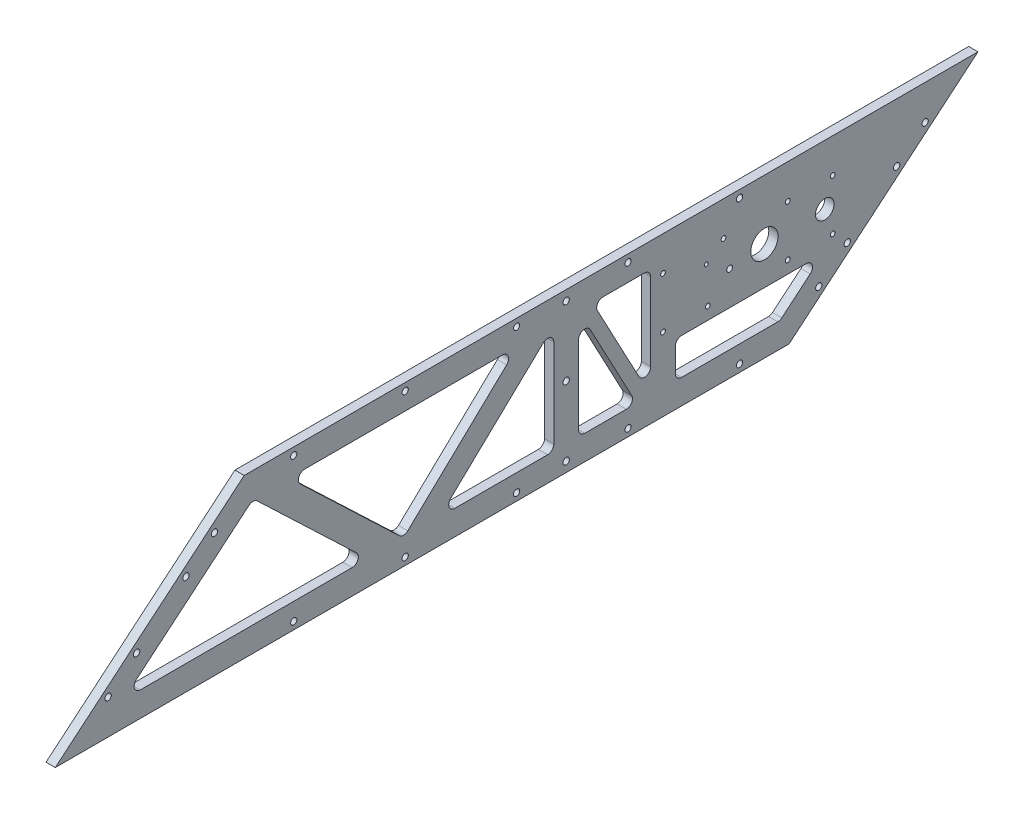
from build123d import *

# Parameters (mm, degrees)
BOSS_EXTRUDE1_DEPTH           = 4.7625
SKETCH2_R                     = 6.9977
SKETCH2_R_2                   = 1.4986
SKETCH2_R_3                   = 0.9906
SKETCH2_R_4                   = 4.7625
GEARBOX_WITH_PRESS_FITS_DEPTH = 412.602247496
SKETCH6_R                     = 1.59385
CUT_EXTRUDE2_DEPTH            = 412.602247496
F_4_CLEARANCE_HOLE2_D         = 3.2639
F_2_CLEARANCE_HOLE1_D         = 2.4384
F_2_CLEARANCE_HOLE1_DEPTH     = 4.826
F_2_CLEARANCE_HOLE1_TIP       = 0.732569267
F_4_CLEARANCE_HOLE1_D         = 3.2639
F_4_CLEARANCE_HOLE1_DEPTH     = 4.826
F_4_CLEARANCE_HOLE1_TIP       = 0.980574487
CUT_EXTRUDE3_DEPTH            = 412.602247496


with BuildPart() as part:
    # Sketch1 → Boss-Extrude1 (new body)
    with BuildSketch(Plane(origin=(0, 0, 0), x_dir=(0, 0, -1), z_dir=(1, 0, 0))):
        Polygon((33.297595377, -40.64), (312.697595377, -40.64), (345.995190754, -12.7), (409.563327383, 40.64), (312.697595377, 40.64), (33.297595377, 40.64), (0, 12.7), (-63.568136629, -40.64), align=None)
    extrude(amount=BOSS_EXTRUDE1_DEPTH)

    # Sketch2 → Gearbox (with Press fits) (cut, through all)
    with BuildSketch(Plane(origin=(4.7625, 0, 0), x_dir=(0, 0, -1), z_dir=(1, 0, 0))):
        with Locations((300.047997426, 10)):
            Circle(SKETCH2_R)
        with Locations((282.214696722, 8)):
            Circle(SKETCH2_R_2)
        with Locations((270.217776392, 15.933400182)):
            Circle(SKETCH2_R_3)
        with Locations((331.004197426, 10)):
            Circle(SKETCH2_R_4)
    extrude(amount=-GEARBOX_WITH_PRESS_FITS_DEPTH, mode=Mode.SUBTRACT)

    # Sketch6 → Cut-Extrude2 (cut, through all)
    with BuildSketch(Plane(origin=(4.7625, 0, 0), x_dir=(0, 0, -1), z_dir=(1, 0, 0))):
        with Locations((287.297595377, 36.83)):
            Circle(SKETCH6_R)
        with Locations((230.147595377, 36.83)):
            Circle(SKETCH6_R)
        with Locations((172.997595377, 36.83)):
            Circle(SKETCH6_R)
        with Locations((115.847595377, 36.83)):
            Circle(SKETCH6_R)
        with Locations((58.697595377, 36.83)):
            Circle(SKETCH6_R)
        with Locations((58.697595377, -36.83)):
            Circle(SKETCH6_R)
        with Locations((115.847595377, -36.83)):
            Circle(SKETCH6_R)
        with Locations((172.997595377, -36.83)):
            Circle(SKETCH6_R)
        with Locations((230.147595377, -36.83)):
            Circle(SKETCH6_R)
        with Locations((287.297595377, -36.83)):
            Circle(SKETCH6_R)
    extrude(amount=-CUT_EXTRUDE2_DEPTH, mode=Mode.SUBTRACT)

    # #4 Clearance Hole2 (through all)
    with Locations(Plane(origin=(4.7625, 0, 0), x_dir=(0, 0, -1), z_dir=(1, 0, 0))):
        with Locations((198.397595377, 35.56), (198.397595377, -35.56), (198.397595377, 0)):
            Hole(F_4_CLEARANCE_HOLE2_D / 2)

    # #2 Clearance Hole1
    with Locations(Plane(origin=(4.7625, 0, 0), x_dir=(0, 0, -1), z_dir=(1, 0, 0))):
        with Locations((248.047997486, -3), (248.047997486, 23), (271.047997556, -3), (312.047997486, -3), (279.047997486, 23), (312.047997486, 23), (335.047997486, 23), (335.047997486, -3)):
            Hole(F_2_CLEARANCE_HOLE1_D / 2, depth=F_2_CLEARANCE_HOLE1_DEPTH)
            with Locations((0, 0, -(F_2_CLEARANCE_HOLE1_DEPTH + F_2_CLEARANCE_HOLE1_TIP / 2))):  # 118° drill point
                Cone(0, F_2_CLEARANCE_HOLE1_D / 2, F_2_CLEARANCE_HOLE1_TIP, mode=Mode.SUBTRACT)

    # #4 Clearance Hole1
    with Locations(Plane(origin=(4.7625, 0, 0), x_dir=(0, 0, -1), z_dir=(1, 0, 0))):
        with Locations((327.962613202, -22.8575274), (342.555759844, -10.612423436), (367.850547356, 10.612423436), (382.443693997, 22.8575274), (-36.448503243, -22.8575274), (-21.855356602, -10.612423436), (3.43943091, 10.612423436), (18.032577552, 22.8575274)):
            Hole(F_4_CLEARANCE_HOLE1_D / 2, depth=F_4_CLEARANCE_HOLE1_DEPTH)
            with Locations((0, 0, -(F_4_CLEARANCE_HOLE1_DEPTH + F_4_CLEARANCE_HOLE1_TIP / 2))):  # 118° drill point
                Cone(0, F_4_CLEARANCE_HOLE1_D / 2, F_4_CLEARANCE_HOLE1_TIP, mode=Mode.SUBTRACT)

    # Sketch15 → Cut-Extrude3 (cut, through all)
    with BuildSketch(Plane(origin=(4.7625, 0, 0), x_dir=(0, 0, -1), z_dir=(1, 0, 0))):
        with BuildLine():
            Line((217.229565991, 27.94), (238.522997486, 27.94))
            ThreePointArc((238.522997486, 27.94), (240.768061516, 27.01006403), (241.697997486, 24.765))
            Line((241.697997486, 24.765), (241.697997486, -15.222506435))
            ThreePointArc((241.697997486, -15.222506435), (239.292051039, -18.302957966), (235.720560237, -16.71481018))
            Line((235.720560237, -16.71481018), (214.427128742, 23.272696256))
            ThreePointArc((214.427128742, 23.272696256), (214.507554842, 26.399405184), (217.229565991, 27.94))
        make_face()
        with BuildLine():
            Line((210.725032626, 16.71481018), (232.018464121, -23.272696256))
            ThreePointArc((232.018464121, -23.272696256), (231.938038021, -26.399405184), (229.216026872, -27.94))
            Line((229.216026872, -27.94), (207.922595377, -27.94))
            ThreePointArc((207.922595377, -27.94), (205.677531347, -27.01006403), (204.747595377, -24.765))
            Line((204.747595377, -24.765), (204.747595377, 15.222506435))
            ThreePointArc((204.747595377, 15.222506435), (207.153541824, 18.302957966), (210.725032626, 16.71481018))
        make_face()
        with BuildLine():
            Line((35.744876514, 26.114840125), (-21.992783256, -22.332808893))
            ThreePointArc((-21.992783256, -22.332808893), (-22.935456666, -25.850913955), (-19.951932595, -27.94))
            Line((-19.951932595, -27.94), (88.636989544, -27.94))
            ThreePointArc((88.636989544, -27.94), (91.584794367, -25.944437039), (90.827068404, -22.466265655))
            Line((90.827068404, -22.466265655), (39.975806034, 25.981383362))
            ThreePointArc((39.975806034, 25.981383362), (37.885826828, 26.856070682), (35.744876514, 26.114840125))
        make_face()
        with BuildLine():
            Line((62.076755313, 22.466265655), (112.793727505, -25.853440749))
            ThreePointArc((112.793727505, -25.853440749), (114.983806365, -26.729706404), (117.173885225, -25.853440749))
            Line((117.173885225, -25.853440749), (167.890857417, 22.466265655))
            ThreePointArc((167.890857417, 22.466265655), (168.648583379, 25.944437039), (165.700778557, 27.94))
            Line((165.700778557, 27.94), (64.266834173, 27.94))
            ThreePointArc((64.266834173, 27.94), (61.31902935, 25.944437039), (62.076755313, 22.466265655))
        make_face()
        with BuildLine():
            Line((139.140544325, -22.466265655), (186.682516517, 22.828515143))
            ThreePointArc((186.682516517, 22.828515143), (190.123020229, 23.448181506), (192.047595377, 20.529780798))
            Line((192.047595377, 20.529780798), (192.047595377, -24.765))
            ThreePointArc((192.047595377, -24.765), (191.117659407, -27.01006403), (188.872595377, -27.94))
            Line((188.872595377, -27.94), (141.330623185, -27.94))
            ThreePointArc((141.330623185, -27.94), (138.382818363, -25.944437039), (139.140544325, -22.466265655))
        make_face()
        with BuildLine():
            Line((254.397997486, -12.525), (254.397997486, -24.765))
            ThreePointArc((254.397997486, -24.765), (255.327933456, -27.01006403), (257.572997486, -27.94))
            Line((257.572997486, -27.94), (306.919567908, -27.94))
            ThreePointArc((306.919567908, -27.94), (308.005481863, -27.748524071), (308.960418569, -27.197191107))
            Line((308.960418569, -27.197191107), (323.547482542, -14.957191107))
            ThreePointArc((323.547482542, -14.957191107), (324.490155952, -11.439086045), (321.506631881, -9.35))
            Line((321.506631881, -9.35), (257.572997486, -9.35))
            ThreePointArc((257.572997486, -9.35), (255.327933456, -10.27993597), (254.397997486, -12.525))
        make_face()
    extrude(amount=-CUT_EXTRUDE3_DEPTH, mode=Mode.SUBTRACT)


solid = part.part
